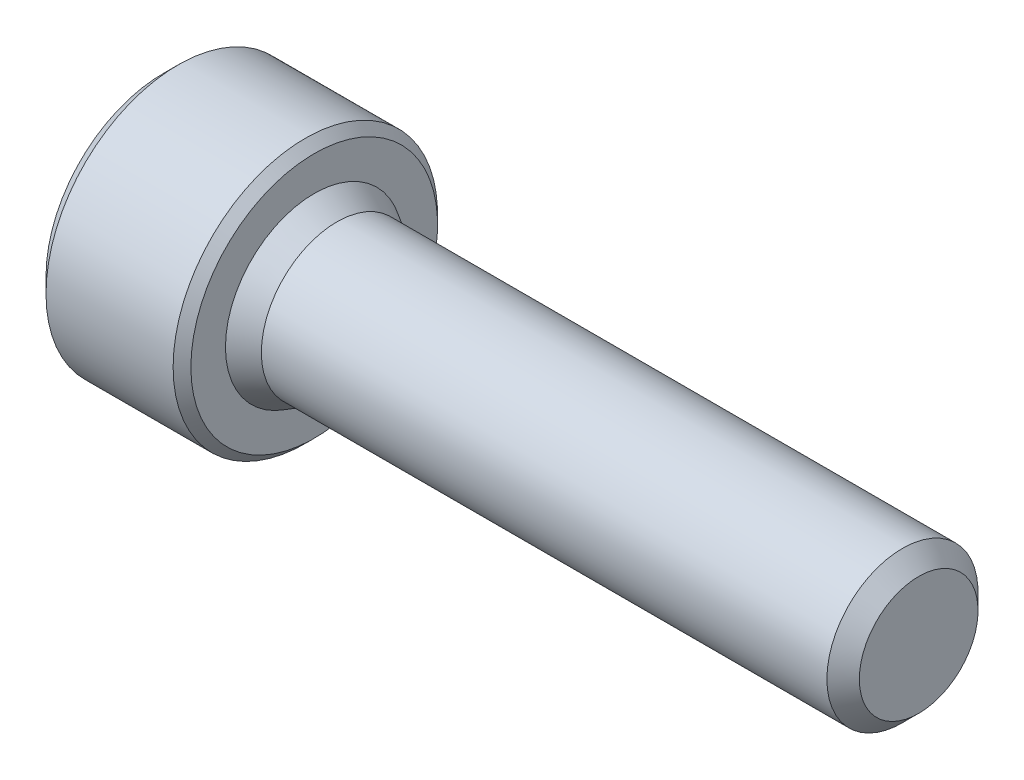
from build123d import *

# Parameters (mm, degrees)
CUT_EXTRUDE1_DEPTH      = 2
CUT_EXTRUDE1_DEPTH_BACK = 2


with BuildPart() as part:
    # Sketch1 → Revolve1 (revolve)
    with BuildSketch(Plane.XY):
        Polygon((-4, 0), (-4, 3.5), (0, 3.5), (0, 2.35), (0.6, 2), (15.5705, 2), (16, 1.5705), (16, 0), align=None)
    revolve(axis=Axis((16, 0, 0), (-1, 0, 0)))

    # Sketch2 → Cut-Revolve1 (revolve, cut)
    with BuildSketch(Plane.XY):
        Polygon((-4, 3.1), (-3.6, 3.5), (-0.235, 3.5), (0, 3.265), (0, 4.2), (-4, 4.2), align=None)
    revolve(axis=Axis((0, 0, 0), (-1, 0, 0)), mode=Mode.SUBTRACT)

    # Sketch3 → Cut-Revolve2 (revolve, cut)
    with BuildSketch(Plane.XY):
        Polygon((-4, 0), (-4, 1.71), (-3.79, 1.5), (-2, 1.5), (-1.133974596, 0), align=None)
    revolve(axis=Axis((-1.133974596, 0, 0), (-1, 0, 0)), mode=Mode.SUBTRACT)

    # Sketch4 → Cut-Extrude1 (cut, two sides: drawn at the far end of the back side and taken through both)
    with BuildSketch(Plane(origin=(-4, 0, 0), x_dir=(0, 0, -1), z_dir=(1, 0, 0)).offset(-CUT_EXTRUDE1_DEPTH_BACK)):
        Polygon((-1.5, -0.866025404), (0, -1.732050808), (1.5, -0.866025404), (1.5, 0.866025404), (0, 1.732050808), (-1.5, 0.866025404), align=None)
    extrude(amount=CUT_EXTRUDE1_DEPTH + CUT_EXTRUDE1_DEPTH_BACK, mode=Mode.SUBTRACT)


solid = part.part
